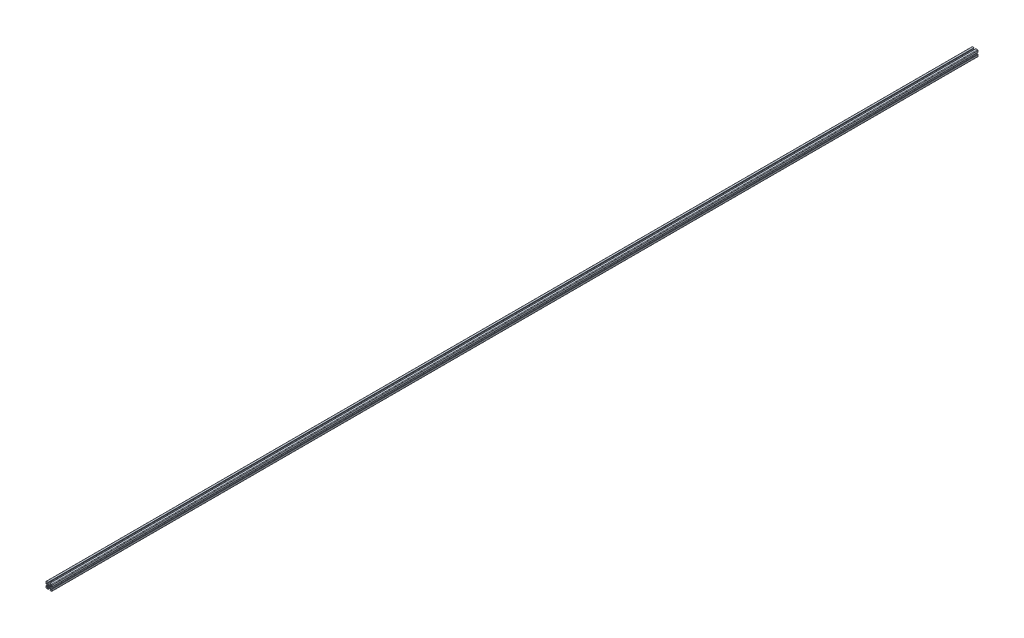
from build123d import *

# Parameters (mm, degrees)
BOSS_EXTRUDE1_DEPTH = 1524


with BuildPart() as part:
    # Sketch4 → Boss-Extrude1 (new, symmetric)
    with BuildSketch(Plane.XY):
        with BuildLine():
            Line((3, -10), (8.25, -10))
            ThreePointArc((8.25, -10), (9.487436867, -9.487436867), (10, -8.25))
            Line((10, -8.25), (10, -3))
            ThreePointArc((10, -3), (9.853553391, -2.646446609), (9.5, -2.5))
            Line((9.5, -2.5), (8.424621202, -2.5))
            ThreePointArc((8.424621202, -2.5), (8.071067812, -2.646446609), (7.924621202, -3))
            Line((7.924621202, -3), (7.924621202, -5.25))
            ThreePointArc((7.924621202, -5.25), (7.615962919, -5.711939766), (7.071067812, -5.603553391))
            Line((7.071067812, -5.603553391), (4.478679656, -3.011165235))
            ThreePointArc((4.478679656, -3.011165235), (3.828361402, -2.037895189), (3.6, -0.889844892))
            Line((3.6, -0.889844892), (3.6, 0))
            Line((3.6, 0), (2.15, 0))
            ThreePointArc((2.15, 0), (1.52027958, -1.52027958), (0, -2.15))
            Line((0, -2.15), (0, -3.6))
            Line((0, -3.6), (0.889844892, -3.6))
            ThreePointArc((0.889844892, -3.6), (2.037895189, -3.828361402), (3.011165235, -4.478679656))
            Line((3.011165235, -4.478679656), (5.603553391, -7.071067812))
            ThreePointArc((5.603553391, -7.071067812), (5.711939766, -7.615962919), (5.25, -7.924621202))
            Line((5.25, -7.924621202), (3, -7.924621202))
            ThreePointArc((3, -7.924621202), (2.646446609, -8.071067812), (2.5, -8.424621202))
            Line((2.5, -8.424621202), (2.5, -9.5))
            ThreePointArc((2.5, -9.5), (2.646446609, -9.853553391), (3, -10))
        make_face()
    extrude(amount=BOSS_EXTRUDE1_DEPTH, both=True)

    # Mirror1: part across plane


with BuildPart() as part_1:
    add(part.part)
    add(part.part.mirror(Plane(origin=(0, 0, 0), x_dir=(0, 0, 1), z_dir=(1, 0, 0))))

    # Mirror2: part across plane


with BuildPart() as part_2:
    add(part_1.part)
    add(part_1.part.mirror(Plane.ZX))


solid = part_2.part
